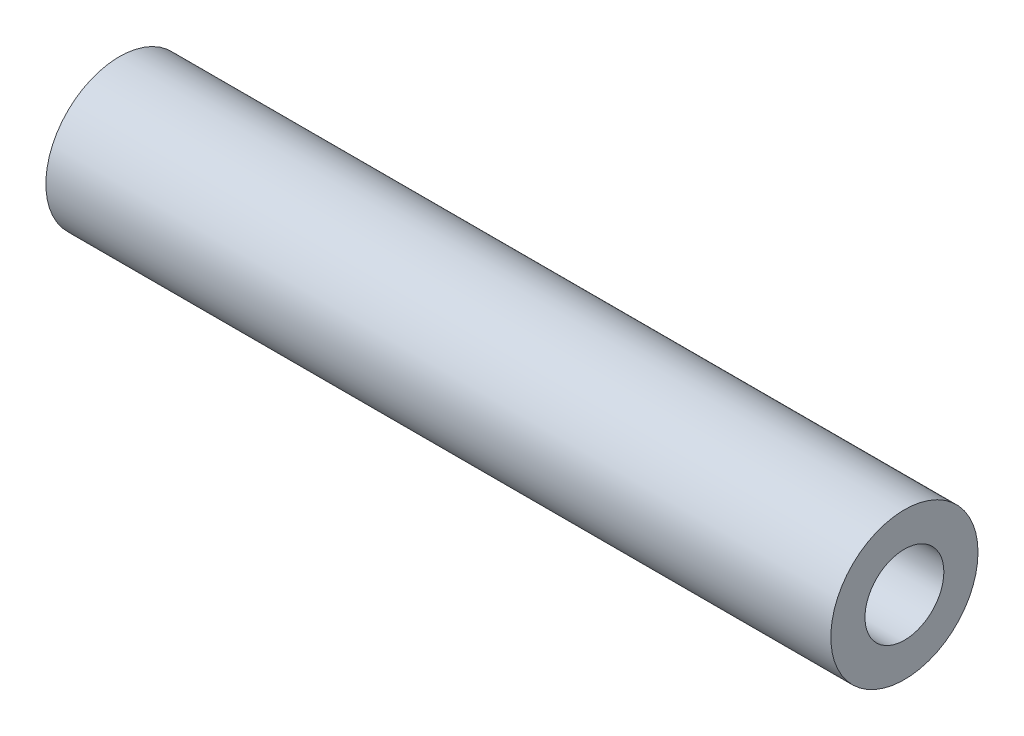
from build123d import *

# Parameters (mm, degrees)
SKETCH1_R           = 4.7625
SKETCH1_R_2         = 2.5527
BOSS_EXTRUDE1_DEPTH = 50.8


with BuildPart() as part:
    # Sketch1 → Boss-Extrude1 (new body)
    with BuildSketch(Plane(origin=(0, 0, 0), x_dir=(0, 0, -1), z_dir=(1, 0, 0))):
        Circle(SKETCH1_R)
        Circle(SKETCH1_R_2, mode=Mode.SUBTRACT)
    extrude(amount=BOSS_EXTRUDE1_DEPTH)


solid = part.part
